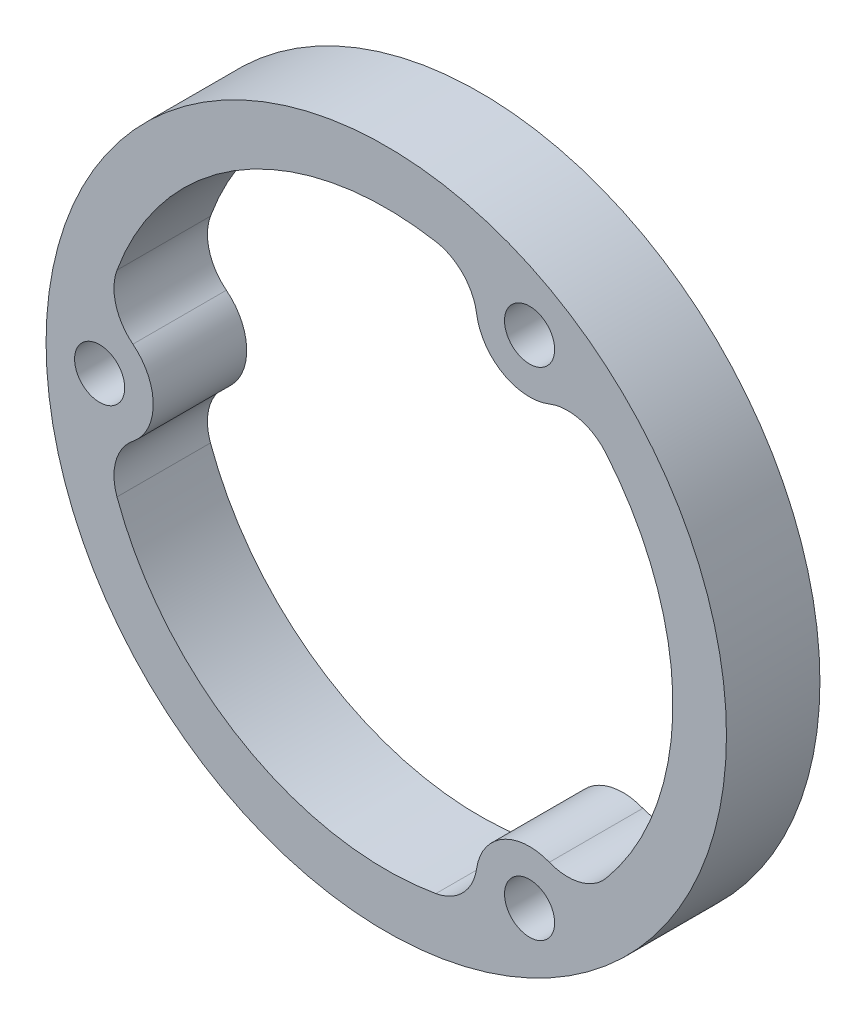
from build123d import *

# Parameters (mm, degrees)
SKETCH1_R                  = 34.671
BOSS_EXTRUDE1_DEPTH        = 9.525
FILLET1_R                  = 5.08
SKETCH2_R                  = 4.0005
CUT_EXTRUDE1_DEPTH         = 5.08
F_10_CLEARANCE_HOLE1_D     = 5.1054
F_10_CLEARANCE_HOLE1_DEPTH = 4.445


with BuildPart() as part:
    # Sketch1 → Boss-Extrude1 (new body)
    with BuildSketch(Plane.XY):
        with Locations(Location((0, 0, 0), (0, 0, 180))):
            Circle(SKETCH1_R)
        with BuildLine():
            ThreePointArc((19.058413969, -22.135965238), (29.21, 0), (19.058413969, 22.135965238))
            ThreePointArc((19.058413969, 22.135965238), (11.8745, 20.567237314), (9.641101249, 27.573053271))
            ThreePointArc((9.641101249, 27.573053271), (-14.605, 25.296602045), (-28.699515217, 5.437088034))
            ThreePointArc((-28.699515217, 5.437088034), (-23.749, 0), (-28.699515217, -5.437088034))
            ThreePointArc((-28.699515217, -5.437088034), (-14.605, -25.296602045), (9.641101249, -27.573053271))
            ThreePointArc((9.641101249, -27.573053271), (11.8745, -20.567237314), (19.058413969, -22.135965238))
        make_face(mode=Mode.SUBTRACT)
    extrude(amount=BOSS_EXTRUDE1_DEPTH)

    # Fillet1
    fillet1_edges = [part.edges().sort_by_distance(p)[0] for p in [
        (-28.699515217, 5.437088034, 4.7625),
        (-28.699515217, -5.437088034, 4.7625),
        (9.641101249, -27.573053271, 4.7625),
        (19.058413969, -22.135965238, 4.7625),
        (19.058413969, 22.135965238, 4.7625),
        (9.641101249, 27.573053271, 4.7625),
    ]]
    fillet(fillet1_edges, radius=FILLET1_R)

    # Sketch2 → Cut-Extrude1 (cut)
    with BuildSketch(Plane(origin=(0, 0, 0), x_dir=(-1, 0, 0), z_dir=(0, 0, -1))):
        with Locations((-14.605, 25.296602045)):
            Circle(SKETCH2_R)
        with Locations((29.21, 0)):
            Circle(SKETCH2_R)
        with Locations((-14.605, -25.296602045)):
            Circle(SKETCH2_R)
    extrude(amount=-CUT_EXTRUDE1_DEPTH, mode=Mode.SUBTRACT)

    # #10 Clearance Hole1
    with Locations(Plane(origin=(0, 0, 5.08), x_dir=(-1, 0, 0), z_dir=(0, 0, -1))):
        with Locations((-14.605, 25.296602045), (29.21, 0), (-14.605, -25.296602045), (0, 0)):
            Hole(F_10_CLEARANCE_HOLE1_D / 2, depth=F_10_CLEARANCE_HOLE1_DEPTH)


solid = part.part
